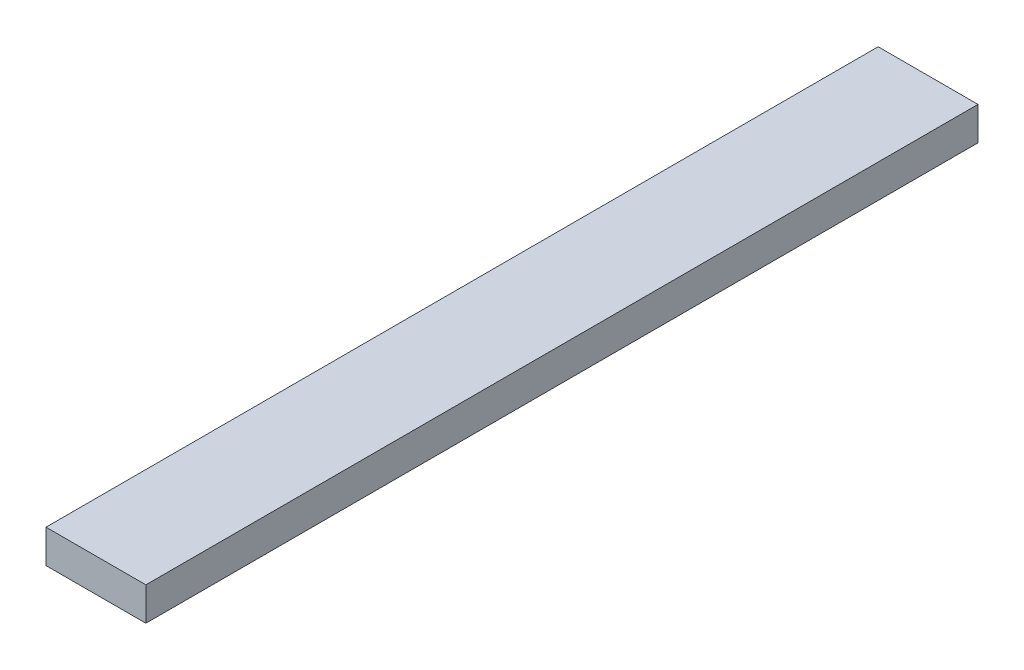
from build123d import *

# Parameters (mm, degrees)
SKETCH2_W           = 60
SKETCH2_H           = 500
BOSS_EXTRUDE1_DEPTH = 10


with BuildPart() as part:
    # Sketch2 → Boss-Extrude1 (new, symmetric)
    with BuildSketch(Plane(origin=(0, 0, 0), x_dir=(1, 0, 0), z_dir=(0, 1, 0))):
        Rectangle(SKETCH2_W, SKETCH2_H)
    extrude(amount=BOSS_EXTRUDE1_DEPTH, both=True)


solid = part.part
